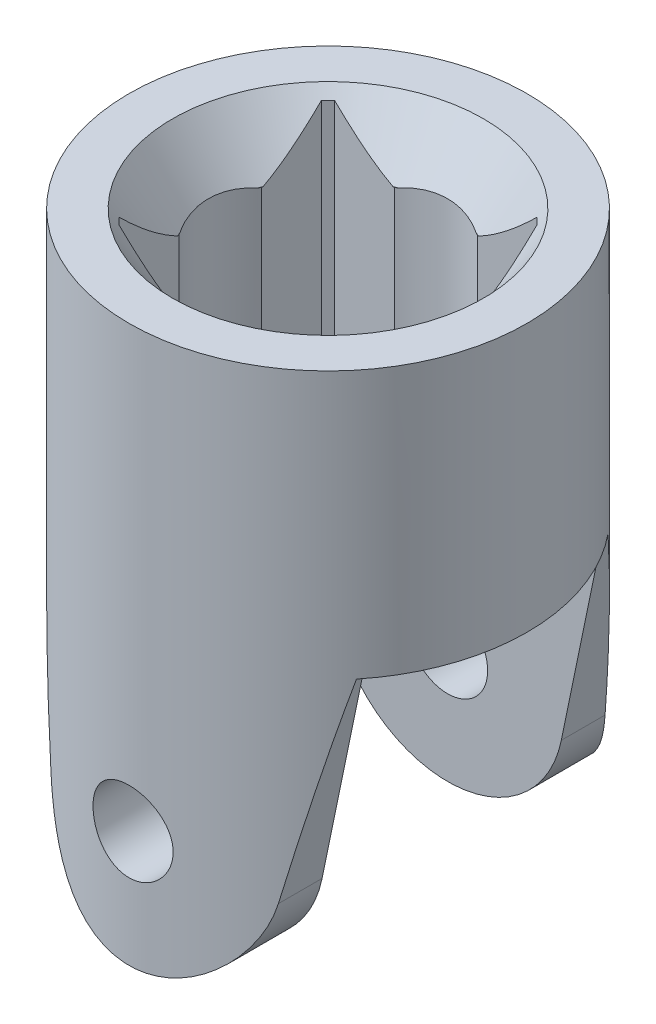
from build123d import *

# Parameters (mm, degrees)
SKETCH1_R           = 12
BOSS_EXTRUDE1_DEPTH = 33.53
CUT_EXTRUDE1_DEPTH  = 19.6
CHAMFER1_SIZE       = 0.4
SKETCH3_R           = 9.375
CUT_EXTRUDE2_DEPTH  = 3.4
CUT_EXTRUDE2_DRAFT  = -35
SKETCH4_W           = 24
SKETCH4_H           = 14.42225279
CUT_EXTRUDE3_DEPTH  = 17.4
SKETCH5_R           = 2.415
CUT_EXTRUDE4_DEPTH  = 33.7
SCALE1_SCALE        = 0.49


with BuildPart() as part:
    # Sketch1 → Boss-Extrude1 (new body)
    with BuildSketch(Plane(origin=(0, 0, 0), x_dir=(1, 0, 0), z_dir=(0, 1, 0))):
        with Locations(Location((0, 0, 0), (0, 0, 270))):
            Circle(SKETCH1_R)
    extrude(amount=BOSS_EXTRUDE1_DEPTH)

    # Sketch2 → Cut-Extrude1 (cut)
    with BuildSketch(Plane(origin=(0, 33.53, 0), x_dir=(1, 0, 0), z_dir=(0, 1, 0))):
        with BuildLine():
            Line((-6.5, 6.5), (-2.5, 6.5))
            ThreePointArc((-2.5, 6.5), (0, 7.211126395), (2.5, 6.5))
            Line((2.5, 6.5), (6.5, 6.5))
            Line((6.5, 6.5), (6.5, 2.5))
            ThreePointArc((6.5, 2.5), (7.211126395, 0), (6.5, -2.5))
            Line((6.5, -2.5), (6.5, -6.5))
            Line((6.5, -6.5), (2.5, -6.5))
            ThreePointArc((2.5, -6.5), (0, -7.211126395), (-2.5, -6.5))
            Line((-2.5, -6.5), (-6.5, -6.5))
            Line((-6.5, -6.5), (-6.5, -2.5))
            ThreePointArc((-6.5, -2.5), (-7.211126395, 0), (-6.5, 2.5))
            Line((-6.5, 2.5), (-6.5, 6.5))
        make_face()
    extrude(amount=-CUT_EXTRUDE1_DEPTH, mode=Mode.SUBTRACT)

    # Chamfer1
    chamfer1_edges = [part.edges().sort_by_distance(p)[0] for p in [
        (-6.5, 23.73, -6.5),
        (6.5, 23.73, -6.5),
        (6.5, 23.73, 6.5),
        (-6.5, 23.73, 6.5),
    ]]
    chamfer(chamfer1_edges, length=CHAMFER1_SIZE)


with BuildPart() as cut_extrude2_tool:
    # Sketch3 → Cut-Extrude2 (with draft: the straight prism first)
    with BuildSketch(Plane(origin=(0, 33.53, 0), x_dir=(1, 0, 0), z_dir=(0, 1, 0))):
        Circle(SKETCH3_R)
    extrude(amount=-CUT_EXTRUDE2_DEPTH)
    # Cut-Extrude2: the draft: its side faces are tilted about the plane it starts from
    cut_extrude2_sides = [cut_extrude2_tool.faces().sort_by_distance(p)[0] for p in [
        (-9.375, 31.83, 0),
    ]]
    draft(cut_extrude2_sides, Plane(origin=(0, 33.53, 0), x_dir=(1, 0, 0), z_dir=(0, 1, 0)), CUT_EXTRUDE2_DRAFT)


with BuildPart() as part_1:
    add(part.part)

    # Cut-Extrude2: cut by cut_extrude2_tool
    add(cut_extrude2_tool.part, mode=Mode.SUBTRACT)

    # Sketch4 → Cut-Extrude3 (cut)
    with BuildSketch(Plane.XZ):
        Rectangle(SKETCH4_W, SKETCH4_H)
    extrude(amount=-CUT_EXTRUDE3_DEPTH, mode=Mode.SUBTRACT)

    # Sketch5 → Cut-Extrude4 (cut, symmetric)
    with BuildSketch(Plane.XY):
        with Locations(Location((0, 7, 0), (0, 0, 90))):
            Circle(SKETCH5_R)
        with BuildLine():
            ThreePointArc((-6.854820161, 5.581747356), (0, 0), (6.854820161, 5.581747356))
            Line((6.854820161, 5.581747356), (9.3, 17.4))
            Line((9.3, 17.4), (12, 17.4))
            Line((12, 17.4), (12, -3.192277431))
            Line((12, -3.192277431), (-12, -3.192277431))
            Line((-12, -3.192277431), (-12, 17.4))
            Line((-12, 17.4), (-9.3, 17.4))
            Line((-9.3, 17.4), (-6.854820161, 5.581747356))
        make_face()
    extrude(amount=CUT_EXTRUDE4_DEPTH, both=True, mode=Mode.SUBTRACT)


with BuildPart() as part_2:
    # Scale1: scaled about (-1.86e-07, 20.712300737, 4.053e-06)
    add(part_1.part.scale(SCALE1_SCALE).moved(Location((-9.5e-08, 10.563273376, 2.067e-06))))


solid = part_2.part
